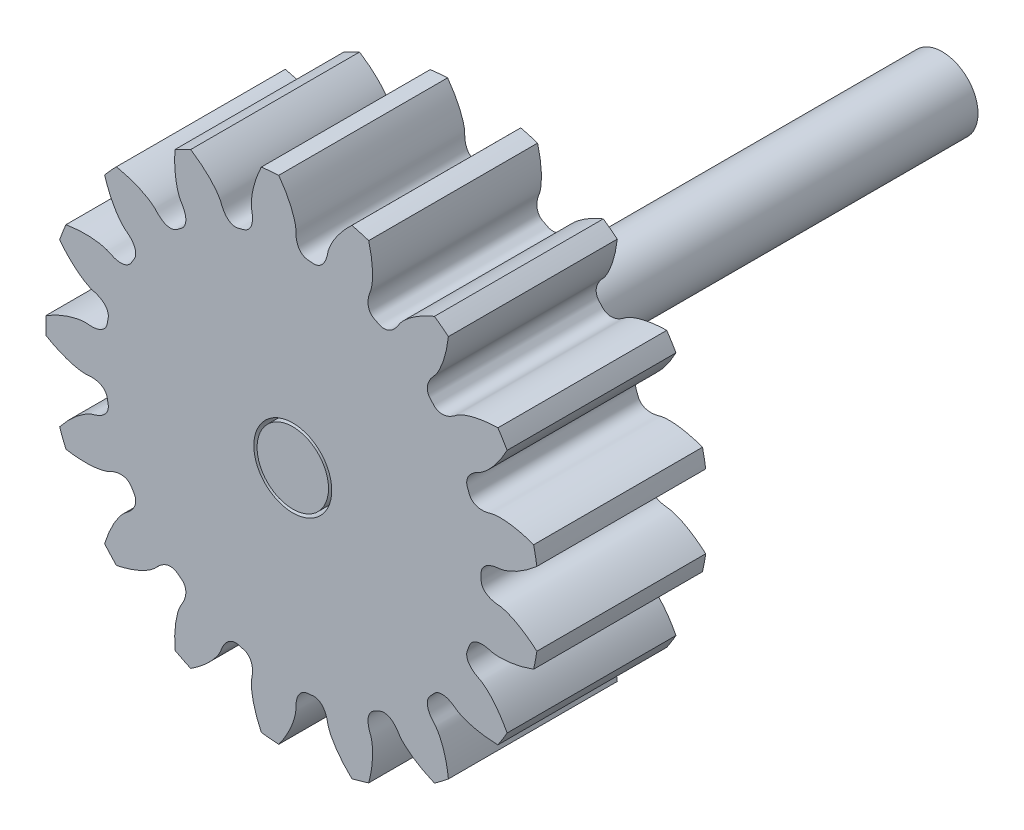
from build123d import *

# Parameters (mm, degrees)
SKETCH_303_W               = 13
SKETCH_303_H               = 18.999999715
CUT_EXTRUDE_542_DEPTH      = 10
PATTERN_CIRCULAR_596_COUNT = 17
SKETCH_631_W               = 20
SKETCH_631_H               = 3
SKETCH1_R                  = 2.75
EXTRUDE1_DEPTH             = 50


with BuildPart() as part:
    # Sketch 303 → Revolve 366 (revolve)
    with BuildSketch(Plane(origin=(0, 0, 0), x_dir=(0, 0, -1), z_dir=(1, 0, 0))):
        with Locations((-3.5, 9.499999858)):
            Rectangle(SKETCH_303_W, SKETCH_303_H)
    revolve(axis=Axis((0, 0, 0), (0, 0, -1)))

    # Sketch 411 → Cut-Extrude 542 (cut, symmetric)
    with BuildSketch(Plane.XY):
        with BuildLine():
            ThreePointArc((18.877658909, 2.905853259), (19.099999713, 0), (18.877658909, -2.905853259))
            add(Edge.make_bspline(
                [(18.877658909, -2.905853259), (18.716157077, -2.760491903), (18.473674685, -2.555466773), (18.146231854, -2.305800395), (17.915616582, -2.141617068), (17.694045744, -1.994557675), (17.482378444, -1.863843394), (17.281432145, -1.748657621), (17.091981124, -1.648148349), (16.91475505, -1.561430027), (16.75043763, -1.487585558), (16.599665344, -1.425668538), (16.463026276, -1.374704812), (16.341059011, -1.333696439), (16.234251655, -1.301618374), (16.143040872, -1.277437356), (16.067811224, -1.260066189), (16.008893984, -1.248498433), (15.908190545, -1.231787486), (15.807316828, -1.229114573), (15.703657001, -1.215951521), (15.649467568, -1.208331777), (15.596258759, -1.199646448), (15.544003852, -1.190006775), (15.492690854, -1.17937343), (15.442301512, -1.167741383), (15.392816806, -1.155090622), (15.344215565, -1.141398119), (15.296474978, -1.126633588), (15.249570732, -1.110759317), (15.203477429, -1.093728751), (15.158169165, -1.075485196), (15.113620398, -1.05596029), (15.069807181, -1.035072325), (15.026708876, -1.012724457), (14.984310506, -0.988802839), (14.942605916, -0.963174827), (14.901601952, -0.935687429), (14.861323874, -0.906166316), (14.821822218, -0.874415841), (14.78318124, -0.840220712), (14.745528928, -0.803350183), (14.709048241, -0.76356583), (14.67398879, -0.720634147), (14.640677395, -0.674345103), (14.609525194, -0.624537363), (14.581027601, -0.571129886), (14.555754764, -0.514157513), (14.534322936, -0.45380698), (14.517368695, -0.390442448), (14.50543648, -0.324626756), (14.499650458, -0.262572046), (14.497192375, -0.154189358), (14.502240728, 0), (14.497192375, 0.154189358), (14.499650458, 0.262572046), (14.50543648, 0.324626756), (14.517368695, 0.390442448), (14.534322936, 0.45380698), (14.555754764, 0.514157513), (14.581027601, 0.571129886), (14.609525194, 0.624537363), (14.640677395, 0.674345103), (14.67398879, 0.720634147), (14.709048241, 0.76356583), (14.745528928, 0.803350183), (14.78318124, 0.840220712), (14.821822218, 0.874415841), (14.861323874, 0.906166316), (14.901601952, 0.935687429), (14.942605916, 0.963174827), (14.984310506, 0.988802839), (15.026708876, 1.012724457), (15.069807181, 1.035072325), (15.113620398, 1.05596029), (15.158169165, 1.075485196), (15.203477429, 1.093728751), (15.249570732, 1.110759317), (15.296474978, 1.126633588), (15.344215565, 1.141398119), (15.392816806, 1.155090622), (15.442301512, 1.167741383), (15.492690854, 1.17937343), (15.544003852, 1.190006775), (15.596258759, 1.199646448), (15.649467568, 1.208331777), (15.703657001, 1.215951521), (15.807316828, 1.229114573), (15.908190545, 1.231787486), (16.008893984, 1.248498433), (16.067811224, 1.260066189), (16.143040872, 1.277437356), (16.234251655, 1.301618374), (16.341059011, 1.333696439), (16.463026276, 1.374704812), (16.599665344, 1.425668538), (16.75043763, 1.487585558), (16.91475505, 1.561430027), (17.091981124, 1.648148349), (17.281432145, 1.748657621), (17.482378444, 1.863843394), (17.694045744, 1.994557675), (17.915616582, 2.141617068), (18.146231854, 2.305800395), (18.473674685, 2.555466773), (18.716157077, 2.760491903), (18.877658909, 2.905853259)],
                knots=[0, 0, 0, 0, 0.058344307, 0.085213395, 0.110547108, 0.134345443, 0.156608403, 0.177335985, 0.196528192, 0.214185022, 0.230306475, 0.244892552, 0.257943253, 0.269458577, 0.279438525, 0.287883097, 0.294792293, 0.300166112, 0.304004555, 0.322189706, 0.327162426, 0.332059271, 0.336883274, 0.34163777, 0.346326431, 0.350953304, 0.355522857, 0.360040026, 0.364510274, 0.368939642, 0.373334824, 0.377703228, 0.382053055, 0.38639337, 0.390734176, 0.395086475, 0.399462319, 0.403874831, 0.408338175, 0.412867469, 0.417478596, 0.42218788, 0.4270116, 0.431965278, 0.437062734, 0.442314886, 0.447728346, 0.453303917, 0.459035192, 0.46490754, 0.470897788, 0.47697488, 0.481620748, 0.5, 0.518379252, 0.52302512, 0.529102212, 0.53509246, 0.540964808, 0.546696083, 0.552271654, 0.557685114, 0.562937266, 0.568034722, 0.5729884, 0.57781212, 0.582521404, 0.587132531, 0.591661825, 0.596125169, 0.600537681, 0.604913525, 0.609265824, 0.61360663, 0.617946945, 0.622296772, 0.626665176, 0.631060358, 0.635489726, 0.639959974, 0.644477143, 0.649046696, 0.653673569, 0.65836223, 0.663116726, 0.667940729, 0.672837574, 0.677810294, 0.695995445, 0.699833888, 0.705207707, 0.712116903, 0.720561475, 0.730541423, 0.742056747, 0.755107448, 0.769693525, 0.785814978, 0.803471808, 0.822664015, 0.843391597, 0.865654557, 0.889452892, 0.914786605, 0.941655693, 1, 1, 1, 1], degree=3))
        make_face()
    cut_extrude_542 = extrude(amount=CUT_EXTRUDE_542_DEPTH, both=True, mode=Mode.SUBTRACT)

    # Pattern Circular 596: Cut-Extrude 542 ×17 about axis
    pattern_circular_596_axis = Axis((0, 0, 55), (0, 0, -1))
    for i in range(1, PATTERN_CIRCULAR_596_COUNT):
        add(cut_extrude_542.rotate(pattern_circular_596_axis, i * 360 / PATTERN_CIRCULAR_596_COUNT), mode=Mode.SUBTRACT)

    # Sketch 631 → Cut-Revolve 706 (revolve, cut)
    with BuildSketch(Plane(origin=(0, 0, 0), x_dir=(0, 0, -1), z_dir=(1, 0, 0))):
        with Locations((0, 1.5)):
            Rectangle(SKETCH_631_W, SKETCH_631_H)
    revolve(axis=Axis((0, 0, 0), (0, 0, -1)), mode=Mode.SUBTRACT)


with BuildPart() as body_2:
    # Sketch1 → Extrude1 (new body)
    with BuildSketch(Plane.XY.offset(10)):
        Circle(SKETCH1_R)
    extrude(amount=-EXTRUDE1_DEPTH)


solid = Compound([part.part, body_2.part])
